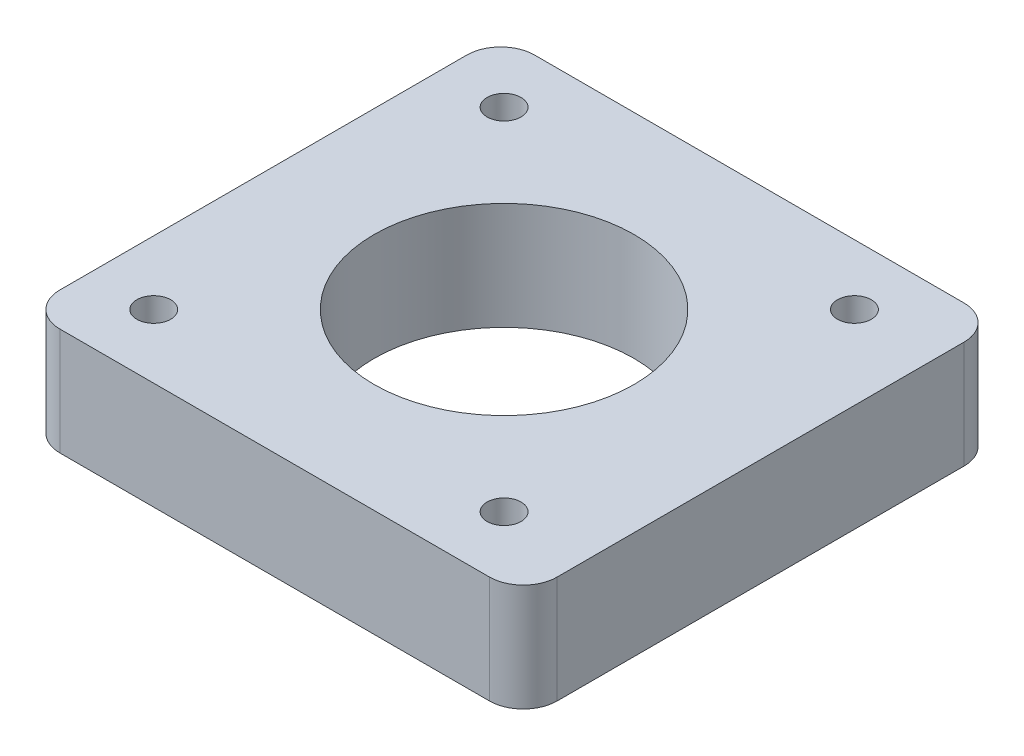
from build123d import *

# Parameters (mm, degrees)
SKETCH_1_W          = 44
SKETCH_1_H          = 42
EXTRUDE_1_DEPTH     = 9.5
SKETCH_2_R          = 11.5
CUT_EXTRUDE_1_DEPTH = 62.565006294
FILLET_1_R          = 3
SKETCH_5_R          = 1.5
CUT_EXTRUDE_2_DEPTH = 62.565006294


with BuildPart() as part:
    # 草图1 → 凸台-拉伸1 (new body)
    with BuildSketch(Plane(origin=(0, 0, 0), x_dir=(1, 0, 0), z_dir=(0, 1, 0))):
        with Locations((22, -21)):
            Rectangle(SKETCH_1_W, SKETCH_1_H)
    extrude(amount=EXTRUDE_1_DEPTH)

    # 草图2 → 切除-拉伸1 (cut, through all)
    with BuildSketch(Plane(origin=(0, 9.5, 0), x_dir=(1, 0, 0), z_dir=(0, 1, 0))):
        with Locations(Location((21.15, -20.85, 0), (0, 0, 270))):
            Circle(SKETCH_2_R)
    extrude(amount=-CUT_EXTRUDE_1_DEPTH, mode=Mode.SUBTRACT)

    # 圆角1
    fillet_1_edges = [part.edges().sort_by_distance(p)[0] for p in [
        (0, 4.75, 0),
        (44, 4.75, 0),
        (44, 4.75, 42),
        (0, 4.75, 42),
    ]]
    fillet(fillet_1_edges, radius=FILLET_1_R)

    # 草图5 → 切除-拉伸2 (cut, through all)
    with BuildSketch(Plane.XZ):
        with Locations(Location((36.65, 36.35, 0), (0, 0, 270))):
            Circle(SKETCH_5_R)
        with Locations(Location((5.65, 36.35, 0), (0, 0, 270))):
            Circle(SKETCH_5_R)
        with Locations(Location((5.65, 5.35, 0), (0, 0, 270))):
            Circle(SKETCH_5_R)
        with Locations(Location((36.65, 5.35, 0), (0, 0, 270))):
            Circle(SKETCH_5_R)
    extrude(amount=-CUT_EXTRUDE_2_DEPTH, mode=Mode.SUBTRACT)


solid = part.part
